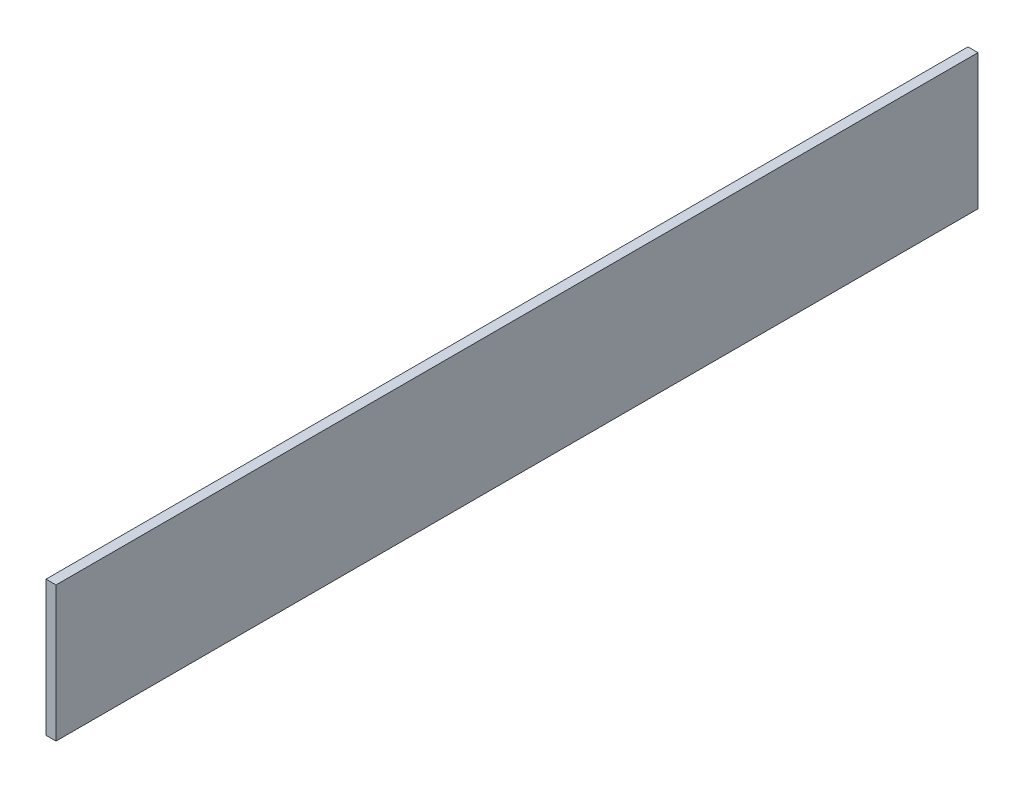
from build123d import *

# Parameters (mm, degrees)
CROQUIS1_W              = 10
CROQUIS1_H              = 135
SALIENTE_EXTRUIR1_DEPTH = 920


with BuildPart() as part:
    # Croquis1 → Saliente-Extruir1 (new body)
    with BuildSketch(Plane.XY):
        Rectangle(CROQUIS1_W, CROQUIS1_H)
    extrude(amount=SALIENTE_EXTRUIR1_DEPTH)


solid = part.part
